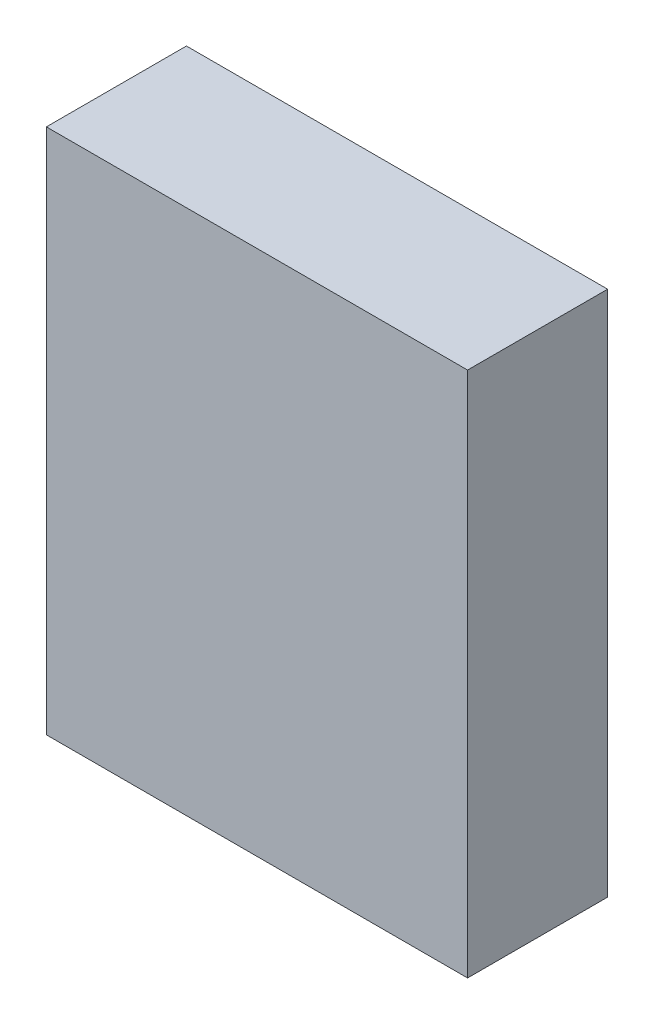
from build123d import *

# Parameters (mm, degrees)
SKETCH1_W           = 400
SKETCH1_H           = 500
BOSS_EXTRUDE1_DEPTH = 150
SKETCH2_W           = 400
SKETCH2_H           = 500
SKETCH2_W_2         = 355
SKETCH2_H_2         = 460
CUT_EXTRUDE1_DEPTH  = 17
SHELL1_T            = -1.5
SKETCH3_R           = 7.5
BOSS_EXTRUDE2_DEPTH = 14


with BuildPart() as part:
    # Sketch1 → Boss-Extrude1 (new body)
    with BuildSketch(Plane.XY):
        Rectangle(SKETCH1_W, SKETCH1_H)
    extrude(amount=BOSS_EXTRUDE1_DEPTH)

    # Sketch2 → Cut-Extrude1 (cut)
    with BuildSketch(Plane(origin=(0, 0, 0), x_dir=(-1, 0, 0), z_dir=(0, 0, -1))):
        Rectangle(SKETCH2_W, SKETCH2_H)
        Rectangle(SKETCH2_W_2, SKETCH2_H_2, mode=Mode.SUBTRACT)
    extrude(amount=-CUT_EXTRUDE1_DEPTH, mode=Mode.SUBTRACT)

    # Shell1
    shell1_openings = [part.faces().sort_by_distance(p)[0] for p in [
        (0, 0, 0),
    ]]
    offset(amount=SHELL1_T, openings=shell1_openings, kind=Kind.INTERSECTION)

    # Sketch3 → Boss-Extrude2 (add)
    with BuildSketch(Plane(origin=(0, 0, 148.5), x_dir=(-1, 0, 0), z_dir=(0, 0, -1))):
        with Locations(Location((-162.5, 202.5, 0), (0, 0, 180))):
            Circle(SKETCH3_R)
        with Locations(Location((162.5, 202.5, 0), (0, 0, 180))):
            Circle(SKETCH3_R)
        with Locations(Location((162.5, -202.5, 0), (0, 0, 180))):
            Circle(SKETCH3_R)
        with Locations(Location((-162.5, -202.5, 0), (0, 0, 180))):
            Circle(SKETCH3_R)
    extrude(amount=BOSS_EXTRUDE2_DEPTH)


solid = part.part
